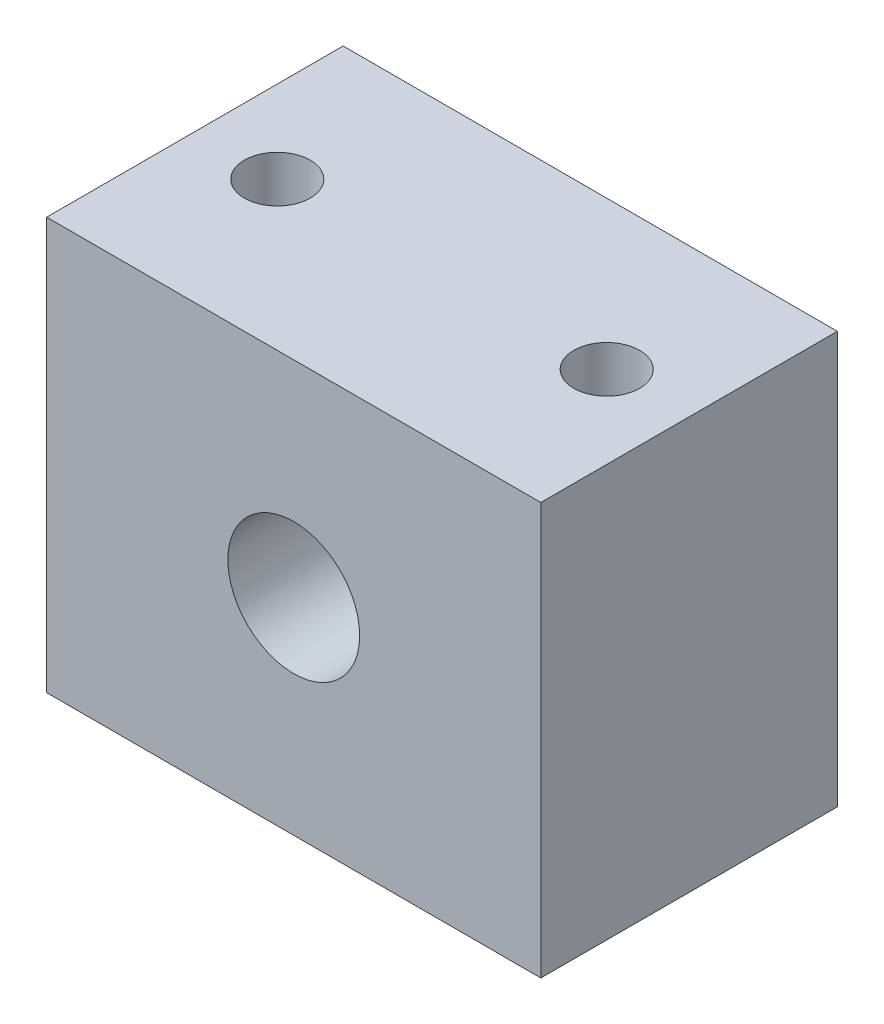
from build123d import *

# Parameters (mm, degrees)
SKETCH1_W           = 30
SKETCH1_H           = 25
SKETCH1_R           = 4
BOSS_EXTRUDE1_DEPTH = 18
SKETCH3_R           = 2
CUT_EXTRUDE1_DEPTH  = 35.263683398


with BuildPart() as part:
    # Sketch1 → Boss-Extrude1 (new body)
    with BuildSketch(Plane.XY):
        Rectangle(SKETCH1_W, SKETCH1_H)
        Circle(SKETCH1_R, mode=Mode.SUBTRACT)
    extrude(amount=BOSS_EXTRUDE1_DEPTH)

    # Sketch3 → Cut-Extrude1 (cut, through all)
    with BuildSketch(Plane(origin=(0, 12.5, 0), x_dir=(1, 0, 0), z_dir=(0, 1, 0))):
        with Locations(Location((-10, -9, 0), (0, 0, 270))):
            Circle(SKETCH3_R)
        with Locations(Location((10, -9, 0), (0, 0, 90))):
            Circle(SKETCH3_R)
    extrude(amount=-CUT_EXTRUDE1_DEPTH, mode=Mode.SUBTRACT)


solid = part.part
